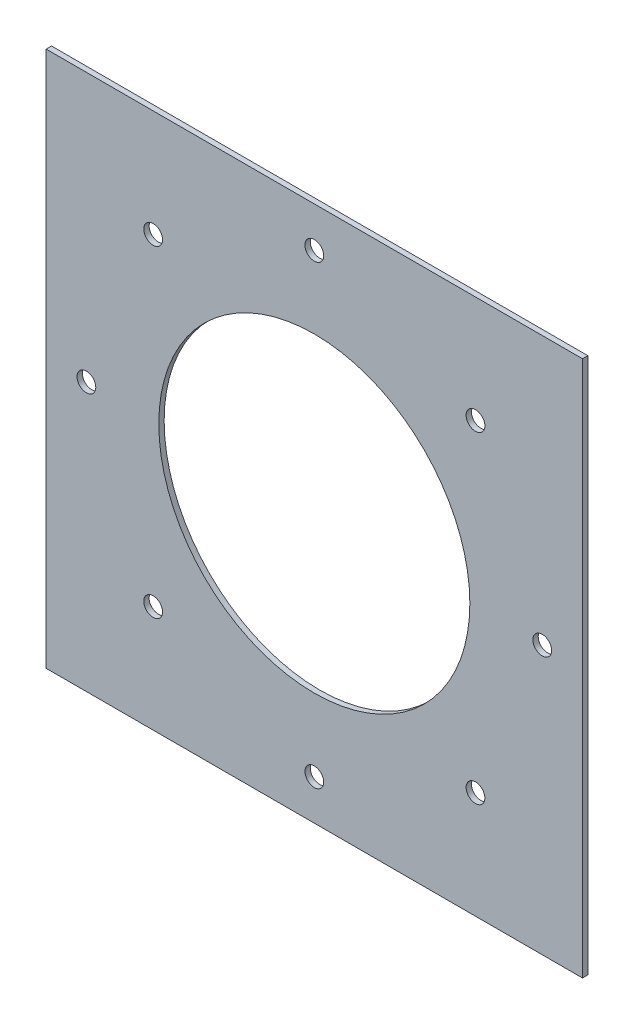
from build123d import *

# Parameters (mm, degrees)
SKETCH_1_W          = 100
SKETCH_1_H          = 100
EXTRUDE_1_DEPTH     = 1
SKETCH_2_R          = 1.75
CUT_EXTRUDE_1_DEPTH = 4
SKETCH_3_R          = 29
CUT_EXTRUDE_2_DEPTH = 4


with BuildPart() as part:
    # 草图1 → 凸台-拉伸1 (new body)
    with BuildSketch(Plane.XY):
        Rectangle(SKETCH_1_W, SKETCH_1_H)
    extrude(amount=EXTRUDE_1_DEPTH)

    # 草图2 → 切除-拉伸1 (cut)
    with BuildSketch(Plane.XY.offset(1)):
        with Locations((-42.5, 0)):
            Circle(SKETCH_2_R)
        with Locations((-30.0520382, 30.0520382)):
            Circle(SKETCH_2_R)
        with Locations((0, 42.5)):
            Circle(SKETCH_2_R)
        with Locations((30.0520382, 30.0520382)):
            Circle(SKETCH_2_R)
        with Locations((42.5, 0)):
            Circle(SKETCH_2_R)
        with Locations((30.0520382, -30.0520382)):
            Circle(SKETCH_2_R)
        with Locations((0, -42.5)):
            Circle(SKETCH_2_R)
        with Locations((-30.0520382, -30.0520382)):
            Circle(SKETCH_2_R)
    extrude(amount=-CUT_EXTRUDE_1_DEPTH, mode=Mode.SUBTRACT)

    # 草图3 → 切除-拉伸2 (cut)
    with BuildSketch(Plane.XY.offset(1)):
        Circle(SKETCH_3_R)
    extrude(amount=-CUT_EXTRUDE_2_DEPTH, mode=Mode.SUBTRACT)


solid = part.part
